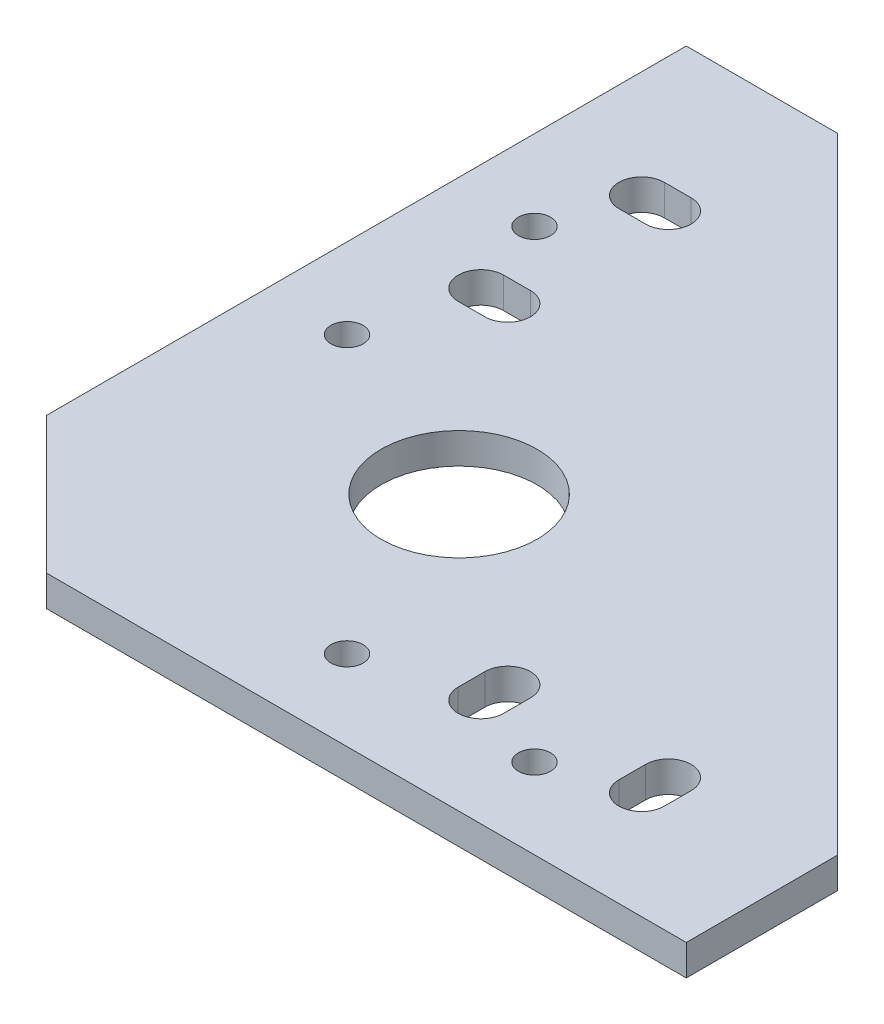
from build123d import *

# Parameters (mm, degrees)
SKETCH_1_R      = 3
SKETCH_1_R_2    = 14.568467703
EXTRUDE_1_DEPTH = 5.75


with BuildPart() as part:
    # 草图1 → 凸台-拉伸1 (new body)
    with BuildSketch(Plane(origin=(0, 0, 0), x_dir=(1, 0, 0), z_dir=(0, 1, 0))):
        Polygon((0, 144.96), (0, 25.455844123), (25.455844123, 0), (144.96, 0), (144.96, 28.284271247), (28.284271247, 144.96), align=None)
        with Locations(Location((66.618795027, 15, 0), (0, 0, 270))):
            Circle(SKETCH_1_R, mode=Mode.SUBTRACT)
        with Locations(Location((15, 66.618795027, 0), (0, 0, 270))):
            Circle(SKETCH_1_R, mode=Mode.SUBTRACT)
        with Locations(Location((51.27, 51.27, 0), (0, 0, 270))):
            Circle(SKETCH_1_R_2, mode=Mode.SUBTRACT)
        with Locations(Location((101.618795027, 15, 0), (0, 0, 270))):
            Circle(SKETCH_1_R, mode=Mode.SUBTRACT)
        with BuildLine():
            ThreePointArc((90.868795027, 20), (86.618795027, 15.75), (82.368795027, 20))
            Line((82.368795027, 20), (82.368795027, 25))
            ThreePointArc((82.368795027, 25), (86.618795027, 29.25), (90.868795027, 25))
            Line((90.868795027, 25), (90.868795027, 20))
        make_face(mode=Mode.SUBTRACT)
        with BuildLine():
            ThreePointArc((120.868795027, 20), (116.618795027, 15.75), (112.368795027, 20))
            Line((112.368795027, 20), (112.368795027, 25))
            ThreePointArc((112.368795027, 25), (116.618795027, 29.25), (120.868795027, 25))
            Line((120.868795027, 25), (120.868795027, 20))
        make_face(mode=Mode.SUBTRACT)
        with BuildLine():
            Line((25, 82.368795027), (20, 82.368795027))
            ThreePointArc((20, 82.368795027), (15.75, 86.618795027), (20, 90.868795027))
            Line((20, 90.868795027), (25, 90.868795027))
            ThreePointArc((25, 90.868795027), (29.25, 86.618795027), (25, 82.368795027))
        make_face(mode=Mode.SUBTRACT)
        with Locations(Location((15, 101.618795027, 0), (0, 0, 270))):
            Circle(SKETCH_1_R, mode=Mode.SUBTRACT)
        with BuildLine():
            Line((25, 112.368795027), (20, 112.368795027))
            ThreePointArc((20, 112.368795027), (15.75, 116.618795027), (20, 120.868795027))
            Line((20, 120.868795027), (25, 120.868795027))
            ThreePointArc((25, 120.868795027), (29.25, 116.618795027), (25, 112.368795027))
        make_face(mode=Mode.SUBTRACT)
    extrude(amount=EXTRUDE_1_DEPTH)


solid = part.part
